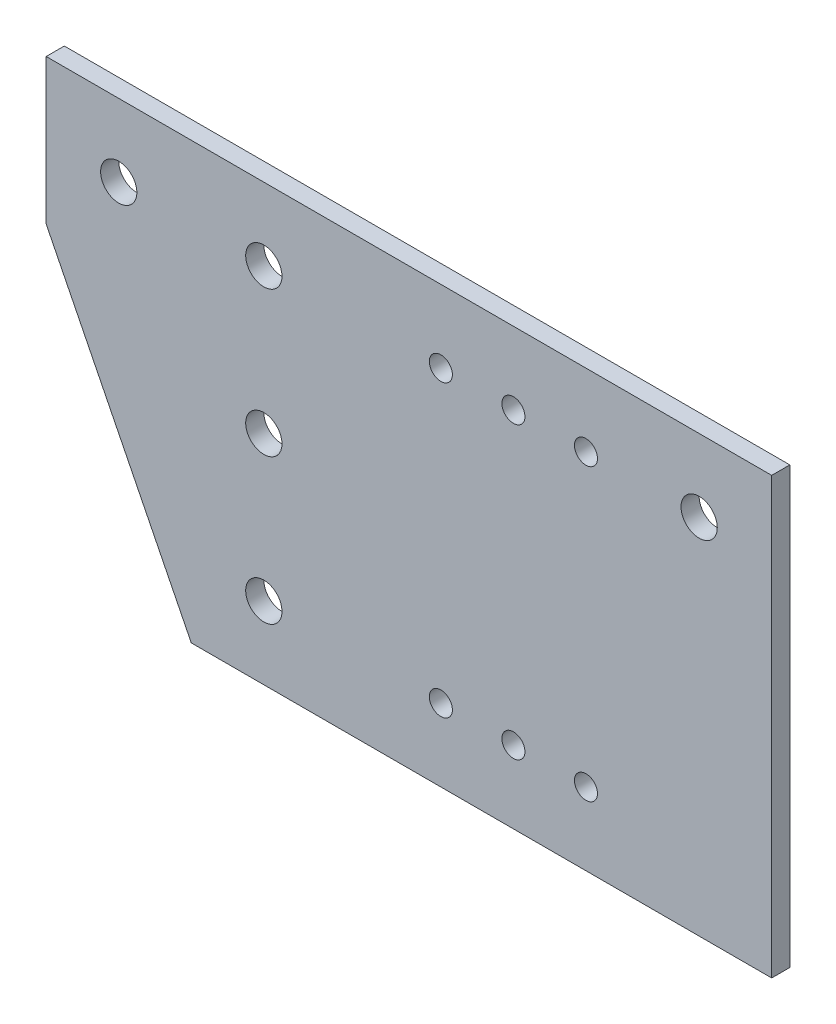
from build123d import *

# Parameters (mm, degrees)
SKETCH4_R           = 3.175
BOSS_EXTRUDE1_DEPTH = 3.175
SKETCH7_R           = 2.0193
CUT_EXTRUDE4_DEPTH  = 5.08


with BuildPart() as part:
    # Sketch4 → Boss-Extrude1 (new body)
    with BuildSketch(Plane.XY):
        Polygon((-38.1, 12.7), (88.9, 12.7), (88.9, -12.7), (88.9, -63.5), (12.7, -63.5), (-12.7, -63.5), (-38.1, -12.7), align=None)
        with Locations((-25.4, 0)):
            Circle(SKETCH4_R, mode=Mode.SUBTRACT)
        Circle(SKETCH4_R, mode=Mode.SUBTRACT)
        with Locations((0, -25.4)):
            Circle(SKETCH4_R, mode=Mode.SUBTRACT)
        with Locations((0, -50.8)):
            Circle(SKETCH4_R, mode=Mode.SUBTRACT)
        with Locations((76.2, 0)):
            Circle(SKETCH4_R, mode=Mode.SUBTRACT)
    extrude(amount=BOSS_EXTRUDE1_DEPTH)

    # Sketch7 → Cut-Extrude4 (cut)
    with BuildSketch(Plane.XY.offset(3.175)):
        with Locations((30.988, -50.8)):
            Circle(SKETCH7_R)
        with Locations((43.688, -50.8)):
            Circle(SKETCH7_R)
        with Locations((56.388, -50.8)):
            Circle(SKETCH7_R)
        with Locations((56.388, 0)):
            Circle(SKETCH7_R)
        with Locations((30.988, 0)):
            Circle(SKETCH7_R)
        with Locations((43.688, 0)):
            Circle(SKETCH7_R)
    extrude(amount=-CUT_EXTRUDE4_DEPTH, mode=Mode.SUBTRACT)


solid = part.part
